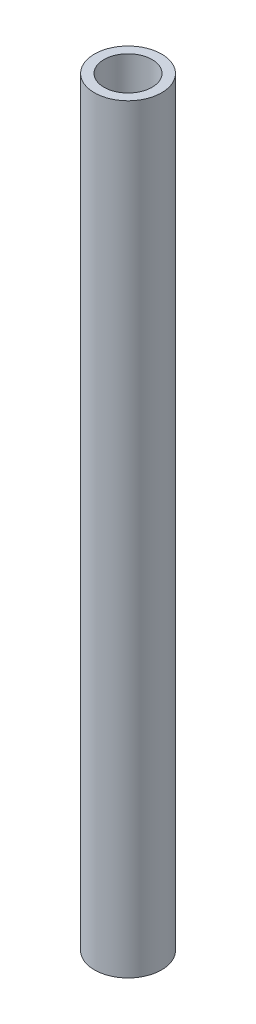
from build123d import *

# Parameters (mm, degrees)
SKETCH1_R           = 10.668
SKETCH1_R_2         = 7.6454
BOSS_EXTRUDE1_DEPTH = 241.3


with BuildPart() as part:
    # Sketch1 → Boss-Extrude1 (new body)
    with BuildSketch(Plane(origin=(0, 0, 0), x_dir=(1, 0, 0), z_dir=(0, 1, 0))):
        with Locations(Location((0, 0, 0), (0, 0, 90))):
            Circle(SKETCH1_R)
        with Locations(Location((0, 0, 0), (0, 0, 90))):
            Circle(SKETCH1_R_2, mode=Mode.SUBTRACT)
    extrude(amount=BOSS_EXTRUDE1_DEPTH)


solid = part.part
